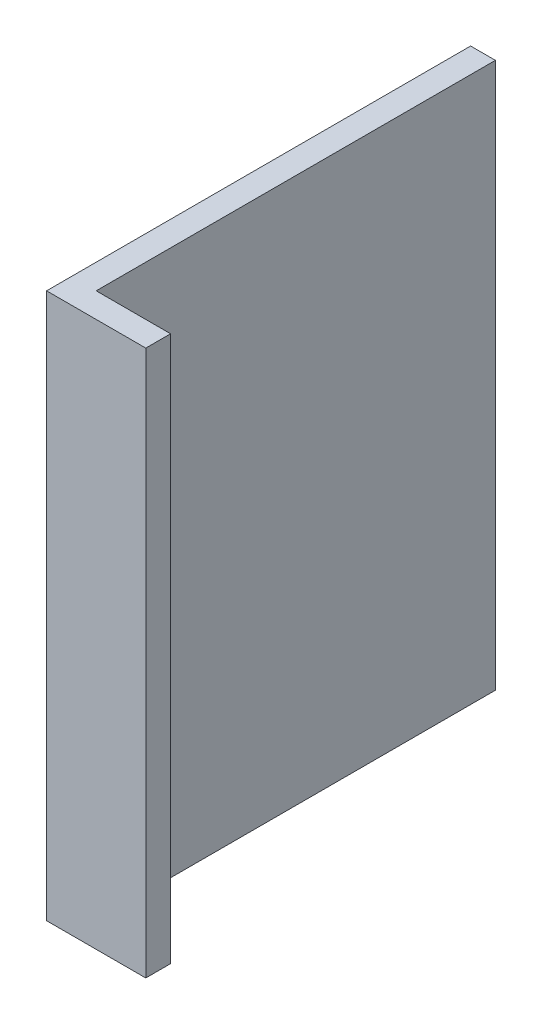
from build123d import *

# Parameters (mm, degrees)
BOSS_EXTRUDE1_DEPTH = 11


with BuildPart() as part:
    # Sketch1 → Boss-Extrude1 (new body)
    with BuildSketch(Plane(origin=(0, 0, 0), x_dir=(1, 0, 0), z_dir=(0, 1, 0))):
        Polygon((-7.560339292, 0), (-9.560339292, 0), (-9.560339292, 8.55), (-9.060339292, 8.55), (-9.060339292, 0.5), (-7.560339292, 0.5), align=None)
    extrude(amount=BOSS_EXTRUDE1_DEPTH)


solid = part.part
